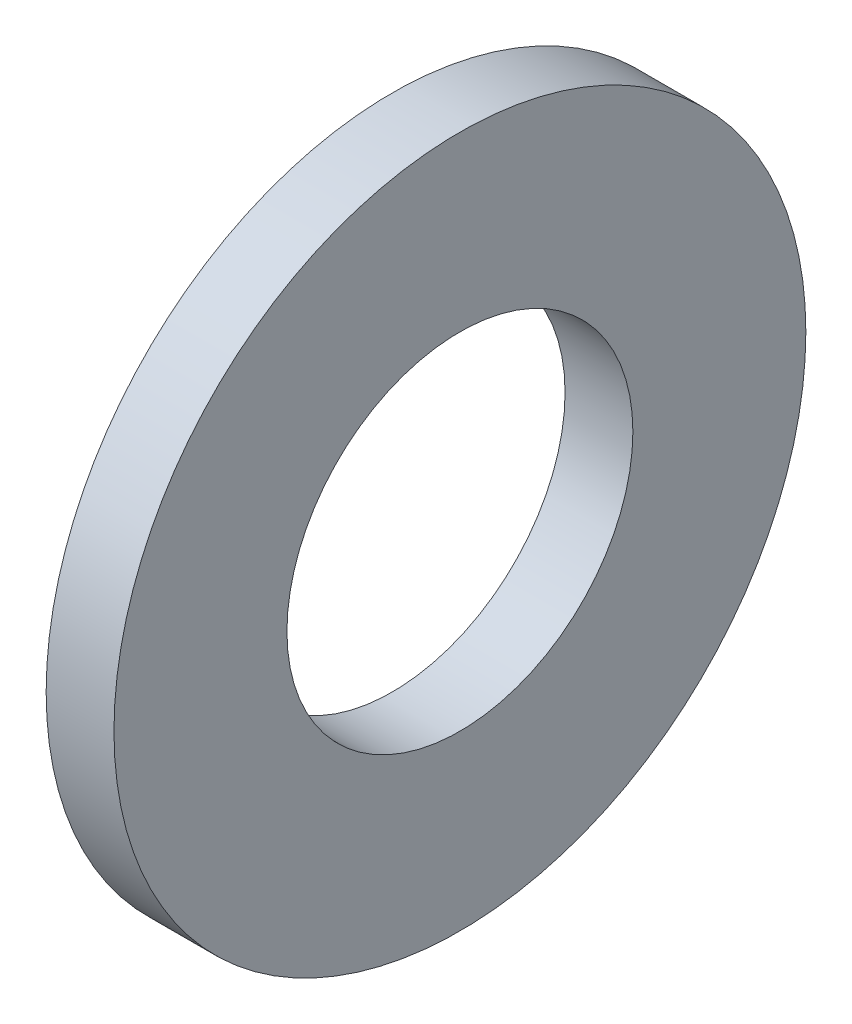
from build123d import *

# Parameters (mm, degrees)
SKETCH1_W = 1.2446
SKETCH1_H = 3.175


with BuildPart() as part:
    # Sketch1 → Base-Revolve (revolve)
    with BuildSketch(Plane.XY, mode=Mode.PRIVATE) as base_revolve_sk:
        with Locations((-0.6223, 4.7625)):
            Rectangle(SKETCH1_W, SKETCH1_H)
    revolve(base_revolve_sk.sketch.rotate(Axis((-34.925, 0, 0), (1, 0, 0)), 90), axis=Axis((-34.925, 0, 0), (1, 0, 0)))


solid = part.part
